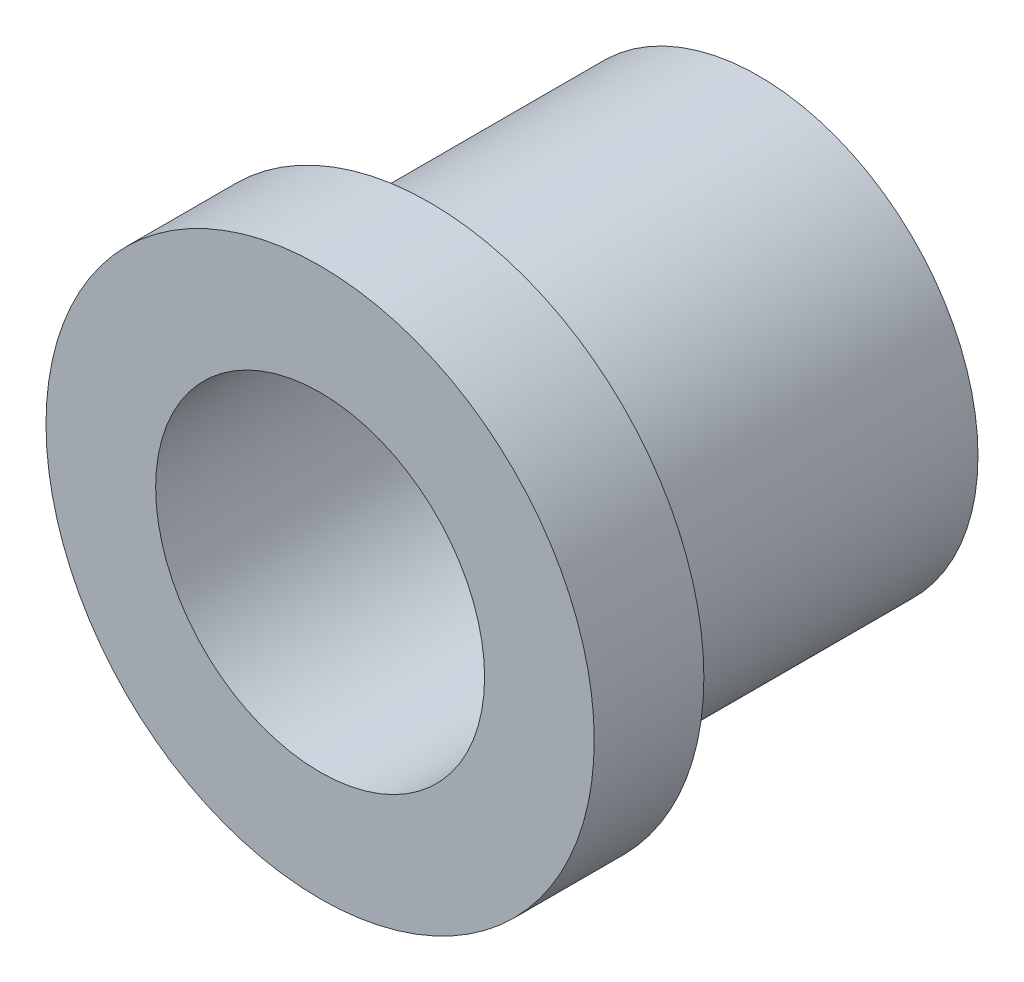
from build123d import *


with BuildPart() as part:
    # Sketch1 → Revolve1 (revolve)
    with BuildSketch(Plane(origin=(0, 0, 0), x_dir=(0, 0, -1), z_dir=(1, 0, 0)), mode=Mode.PRIVATE) as revolve1_sk:
        Polygon((0, 7.9375), (3.175, 7.9375), (3.175, 6.35), (12.7, 6.35), (12.7, 4.7625), (0, 4.7625), align=None)
    revolve(revolve1_sk.sketch.rotate(Axis((0, 0, 0), (0, 0, -1)), 90), axis=Axis((0, 0, 0), (0, 0, -1)))


solid = part.part
